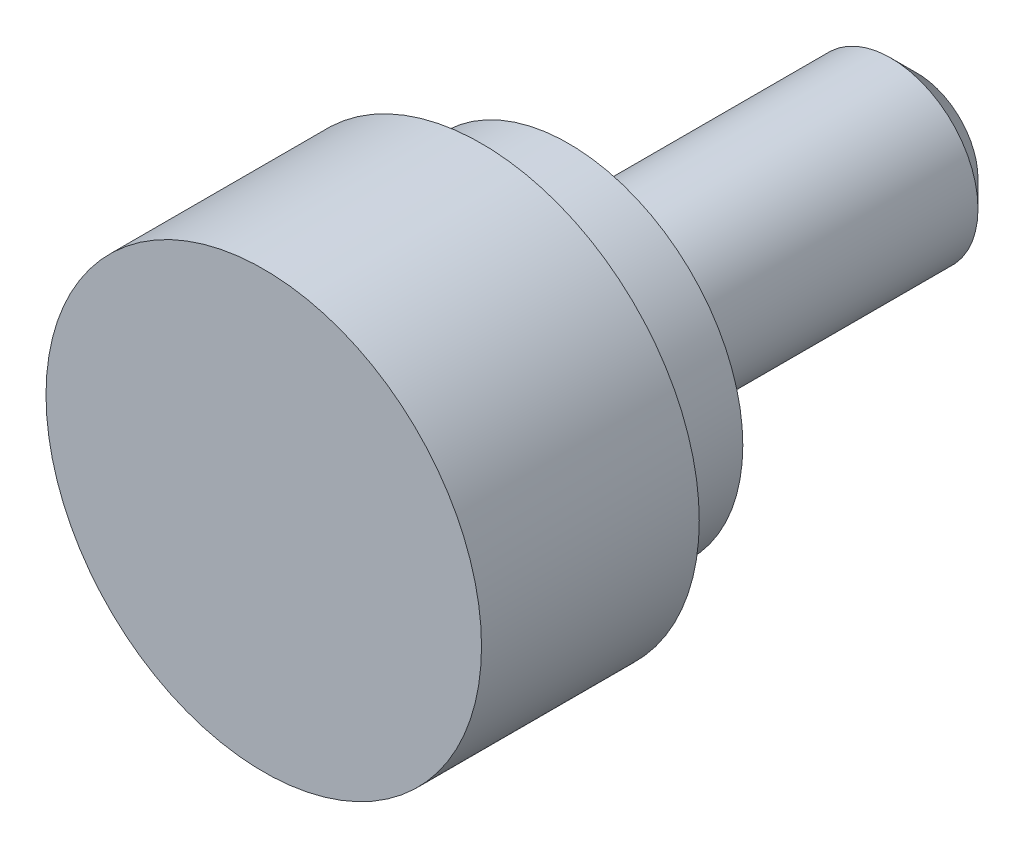
from build123d import *

# Parameters (mm, degrees)
SKETCH1_R           = 3.175
EXTRUDE1_DEPTH      = 12.7
CHAMFER2_SIZE       = 0.9525
SKETCH27_R          = 6.35
BOSS_EXTRUDE4_DEPTH = 3.175
SKETCH21_R          = 7.9375
BOSS_EXTRUDE1_DEPTH = 7.9375


with BuildPart() as part:
    # Sketch1 → Extrude1 (new body)
    with BuildSketch(Plane.XY):
        Circle(SKETCH1_R)
    extrude(amount=-EXTRUDE1_DEPTH)

    # Chamfer2
    chamfer2_edges = [part.edges().sort_by_distance(p)[0] for p in [
        (-3.175, 0, -12.7),
    ]]
    chamfer(chamfer2_edges, length=CHAMFER2_SIZE)

    # Sketch27 → Boss-Extrude4 (add)
    with BuildSketch(Plane.XY):
        Circle(SKETCH27_R)
    extrude(amount=BOSS_EXTRUDE4_DEPTH)

    # Sketch21 → Boss-Extrude1 (add)
    with BuildSketch(Plane.XY.offset(3.175)):
        Circle(SKETCH21_R)
    extrude(amount=BOSS_EXTRUDE1_DEPTH)


solid = part.part
